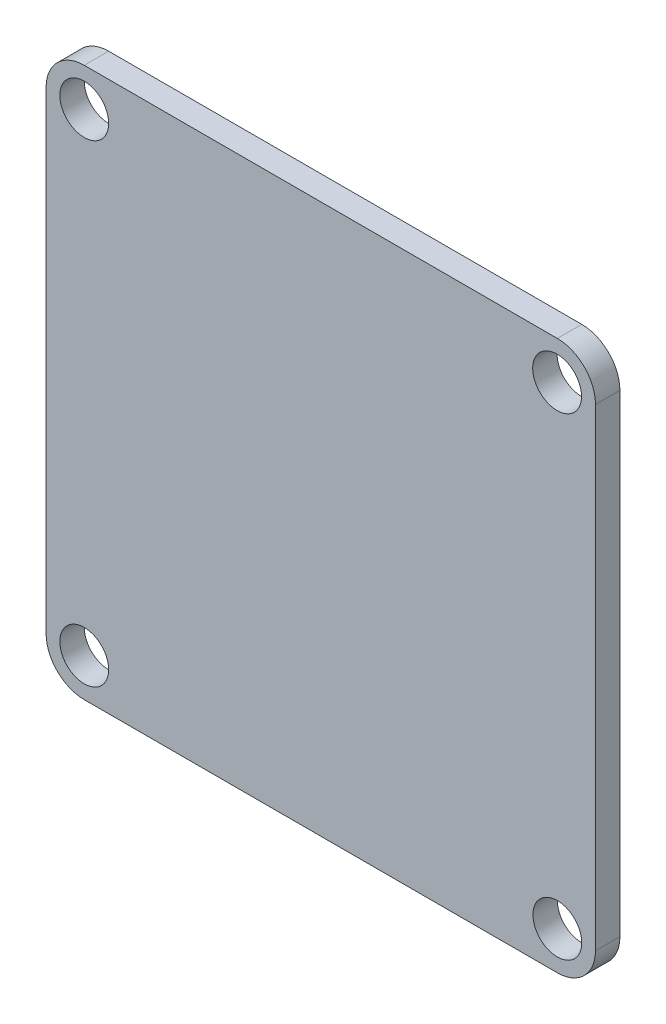
from build123d import *

# Parameters (mm, degrees)
SKETCH2_W           = 36
SKETCH2_H           = 36
BOSS_EXTRUDE1_DEPTH = 1.6
FILLET1_R           = 2.5
CUT_EXTRUDE1_REACH  = 27.506
SKETCH3_R           = 1.6


with BuildPart() as part:
    # Sketch2 → Boss-Extrude1 (new body)
    with BuildSketch(Plane.XY):
        Rectangle(SKETCH2_W, SKETCH2_H)
    extrude(amount=BOSS_EXTRUDE1_DEPTH)

    # Fillet1
    fillet1_edges = [part.edges().sort_by_distance(p)[0] for p in [
        (-18, 18, 0.8),
        (18, 18, 0.8),
        (18, -18, 0.8),
        (-18, -18, 0.8),
    ]]
    fillet(fillet1_edges, radius=FILLET1_R)

    # Sketch3 → Cut-Extrude1 (cut, up to next)
    with BuildSketch(Plane.XY.offset(1.6), mode=Mode.PRIVATE) as cut_extrude1_sk1:
        with Locations((-15.5, -15.5)):
            Circle(SKETCH3_R)
    cut_extrude1_tool1 = extrude(cut_extrude1_sk1.sketch, amount=-CUT_EXTRUDE1_REACH, mode=Mode.PRIVATE) & part.part
    # Sketch3 → Cut-Extrude1 (cut, up to next)
    with BuildSketch(Plane.XY.offset(1.6), mode=Mode.PRIVATE) as cut_extrude1_sk2:
        with Locations((-15.5, 15.5)):
            Circle(SKETCH3_R)
    cut_extrude1_tool2 = extrude(cut_extrude1_sk2.sketch, amount=-CUT_EXTRUDE1_REACH, mode=Mode.PRIVATE) & part.part
    # Sketch3 → Cut-Extrude1 (cut, up to next)
    with BuildSketch(Plane.XY.offset(1.6), mode=Mode.PRIVATE) as cut_extrude1_sk3:
        with Locations((15.48525874, 15.5)):
            Circle(SKETCH3_R)
    cut_extrude1_tool3 = extrude(cut_extrude1_sk3.sketch, amount=-CUT_EXTRUDE1_REACH, mode=Mode.PRIVATE) & part.part
    # Sketch3 → Cut-Extrude1 (cut, up to next)
    with BuildSketch(Plane.XY.offset(1.6), mode=Mode.PRIVATE) as cut_extrude1_sk4:
        with Locations((15.5, -15.5)):
            Circle(SKETCH3_R)
    cut_extrude1_tool4 = extrude(cut_extrude1_sk4.sketch, amount=-CUT_EXTRUDE1_REACH, mode=Mode.PRIVATE) & part.part
    add(cut_extrude1_tool1.solids().sort_by_distance((-15.5, -15.5, 1.6))[0], mode=Mode.SUBTRACT)
    add(cut_extrude1_tool2.solids().sort_by_distance((-15.5, 15.5, 1.6))[0], mode=Mode.SUBTRACT)
    add(cut_extrude1_tool3.solids().sort_by_distance((15.485259, 15.5, 1.6))[0], mode=Mode.SUBTRACT)
    add(cut_extrude1_tool4.solids().sort_by_distance((15.5, -15.5, 1.6))[0], mode=Mode.SUBTRACT)


solid = part.part
